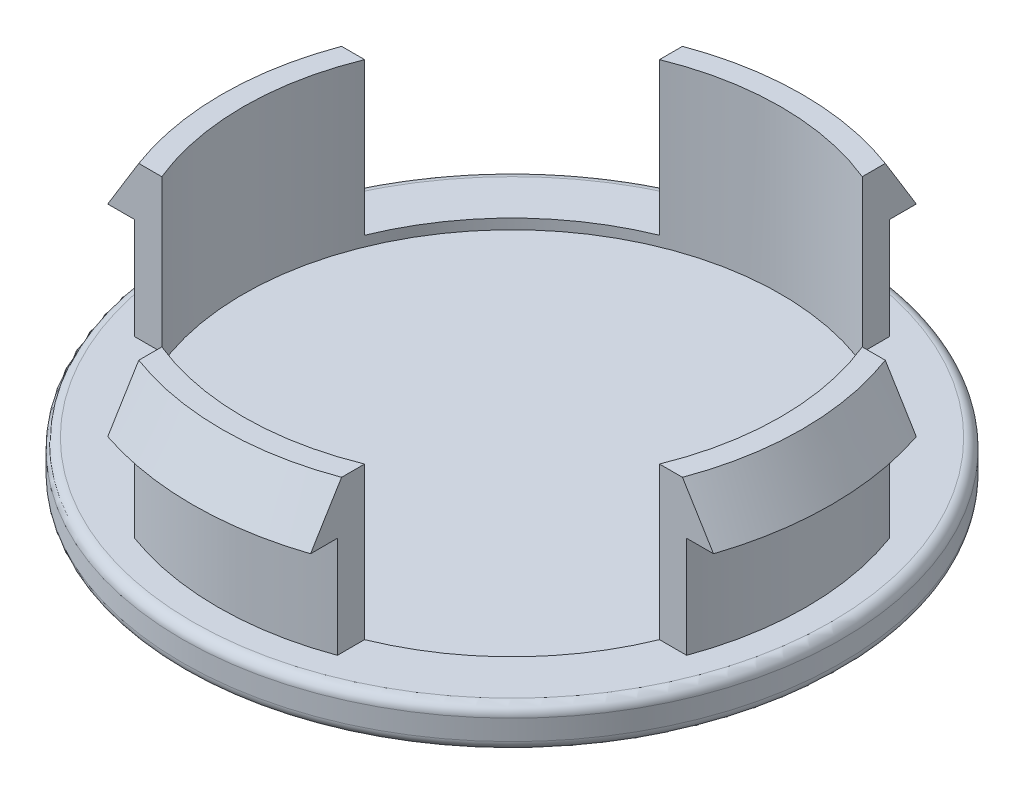
from build123d import *

# Parameters (mm, degrees)
CUT_EXTRUDE_1_REACH = 51.734


with BuildPart() as part:
    # Эскиз1 → Повернуть1 (revolve)
    with BuildSketch(Plane.XY, mode=Mode.PRIVATE) as revolve_1_sk:
        with BuildLine():
            Line((0, 0), (-31.5, 0))
            ThreePointArc((-31.5, 0), (-32.207106781, 0.292893219), (-32.5, 1))
            Line((-32.5, 1), (-32.5, 3))
            ThreePointArc((-32.5, 3), (-32.207106781, 3.707106781), (-31.5, 4))
            Line((-31.5, 4), (-29, 4))
            Line((-29, 4), (-29, 14))
            Line((-29, 14), (-31.5, 14))
            Line((-31.5, 14), (-28.613248654, 19))
            Line((-28.613248654, 19), (-26.5, 19))
            Line((-26.5, 19), (-26.5, 3))
            Line((-26.5, 3), (0, 3))
            Line((0, 3), (0, 0))
        make_face()
    revolve(revolve_1_sk.sketch.rotate(Axis((0, 0, 0), (0, -1, 0)), 270), axis=Axis((0, 0, 0), (0, -1, 0)))

    # Вырез-Вытянуть1: up to this face of the body (flat: up to its plane)
    cut_extrude_1_end = Plane(part.part.faces().sort_by_distance((0, 4, -30.609045456))[0])
    # Эскиз2 → Вырез-Вытянуть1 (cut, up to the picked face)
    with BuildSketch(Plane(origin=(0, 19, 0), x_dir=(1, 0, 0), z_dir=(0, 1, 0)), mode=Mode.PRIVATE) as cut_extrude_1_sk1:
        with BuildLine():
            Line((-10, 26.8089164), (-10, 40.856644609))
            ThreePointArc((-10, 40.856644609), (-29.742775667, 29.742775667), (-40.856644609, 10))
            Line((-40.856644609, 10), (-26.8089164, 10))
            ThreePointArc((-26.8089164, 10), (-20.232622155, 20.232622155), (-10, 26.8089164))
        make_face()
    cut_extrude_1_tool1 = split(extrude(cut_extrude_1_sk1.sketch, amount=-CUT_EXTRUDE_1_REACH, mode=Mode.PRIVATE), bisect_by=cut_extrude_1_end, keep=Keep.BOTH, mode=Mode.PRIVATE)
    # Эскиз2 → Вырез-Вытянуть1 (cut, up to the picked face)
    with BuildSketch(Plane(origin=(0, 19, 0), x_dir=(1, 0, 0), z_dir=(0, 1, 0)), mode=Mode.PRIVATE) as cut_extrude_1_sk2:
        with BuildLine():
            ThreePointArc((26.8089164, 10), (20.232622155, 20.232622155), (10, 26.8089164))
            Line((10, 26.8089164), (10, 24.540782384))
            ThreePointArc((10, 24.540782384), (18.738329701, 18.738329701), (24.540782384, 10))
            Line((24.540782384, 10), (26.8089164, 10))
        make_face()
    cut_extrude_1_tool2 = split(extrude(cut_extrude_1_sk2.sketch, amount=-CUT_EXTRUDE_1_REACH, mode=Mode.PRIVATE), bisect_by=cut_extrude_1_end, keep=Keep.BOTH, mode=Mode.PRIVATE)
    # Эскиз2 → Вырез-Вытянуть1 (cut, up to the picked face)
    with BuildSketch(Plane(origin=(0, 19, 0), x_dir=(1, 0, 0), z_dir=(0, 1, 0)), mode=Mode.PRIVATE) as cut_extrude_1_sk3:
        with BuildLine():
            ThreePointArc((40.856644609, 10), (29.742775667, 29.742775667), (10, 40.856644609))
            Line((10, 40.856644609), (10, 26.8089164))
            ThreePointArc((10, 26.8089164), (20.232622155, 20.232622155), (26.8089164, 10))
            Line((26.8089164, 10), (40.856644609, 10))
        make_face()
    cut_extrude_1_tool3 = split(extrude(cut_extrude_1_sk3.sketch, amount=-CUT_EXTRUDE_1_REACH, mode=Mode.PRIVATE), bisect_by=cut_extrude_1_end, keep=Keep.BOTH, mode=Mode.PRIVATE)
    # Эскиз2 → Вырез-Вытянуть1 (cut, up to the picked face)
    with BuildSketch(Plane(origin=(0, 19, 0), x_dir=(1, 0, 0), z_dir=(0, 1, 0)), mode=Mode.PRIVATE) as cut_extrude_1_sk4:
        with BuildLine():
            ThreePointArc((10, -40.856644609), (29.742775667, -29.742775667), (40.856644609, -10))
            Line((40.856644609, -10), (26.8089164, -10))
            ThreePointArc((26.8089164, -10), (20.232622155, -20.232622155), (10, -26.8089164))
            Line((10, -26.8089164), (10, -40.856644609))
        make_face()
    cut_extrude_1_tool4 = split(extrude(cut_extrude_1_sk4.sketch, amount=-CUT_EXTRUDE_1_REACH, mode=Mode.PRIVATE), bisect_by=cut_extrude_1_end, keep=Keep.BOTH, mode=Mode.PRIVATE)
    # Эскиз2 → Вырез-Вытянуть1 (cut, up to the picked face)
    with BuildSketch(Plane(origin=(0, 19, 0), x_dir=(1, 0, 0), z_dir=(0, 1, 0)), mode=Mode.PRIVATE) as cut_extrude_1_sk5:
        with BuildLine():
            ThreePointArc((10, -26.8089164), (20.232622155, -20.232622155), (26.8089164, -10))
            Line((26.8089164, -10), (24.540782384, -10))
            ThreePointArc((24.540782384, -10), (18.738329701, -18.738329701), (10, -24.540782384))
            Line((10, -24.540782384), (10, -26.8089164))
        make_face()
    cut_extrude_1_tool5 = split(extrude(cut_extrude_1_sk5.sketch, amount=-CUT_EXTRUDE_1_REACH, mode=Mode.PRIVATE), bisect_by=cut_extrude_1_end, keep=Keep.BOTH, mode=Mode.PRIVATE)
    # Эскиз2 → Вырез-Вытянуть1 (cut, up to the picked face)
    with BuildSketch(Plane(origin=(0, 19, 0), x_dir=(1, 0, 0), z_dir=(0, 1, 0)), mode=Mode.PRIVATE) as cut_extrude_1_sk6:
        with BuildLine():
            Line((-26.8089164, -10), (-40.856644609, -10))
            ThreePointArc((-40.856644609, -10), (-29.742775667, -29.742775667), (-10, -40.856644609))
            Line((-10, -40.856644609), (-10, -26.8089164))
            ThreePointArc((-10, -26.8089164), (-20.232622155, -20.232622155), (-26.8089164, -10))
        make_face()
    cut_extrude_1_tool6 = split(extrude(cut_extrude_1_sk6.sketch, amount=-CUT_EXTRUDE_1_REACH, mode=Mode.PRIVATE), bisect_by=cut_extrude_1_end, keep=Keep.BOTH, mode=Mode.PRIVATE)
    # Эскиз2 → Вырез-Вытянуть1 (cut, up to the picked face)
    with BuildSketch(Plane(origin=(0, 19, 0), x_dir=(1, 0, 0), z_dir=(0, 1, 0)), mode=Mode.PRIVATE) as cut_extrude_1_sk7:
        with BuildLine():
            Line((-24.540782384, -10), (-26.8089164, -10))
            ThreePointArc((-26.8089164, -10), (-20.232622155, -20.232622155), (-10, -26.8089164))
            Line((-10, -26.8089164), (-10, -24.540782384))
            ThreePointArc((-10, -24.540782384), (-18.738329701, -18.738329701), (-24.540782384, -10))
        make_face()
    cut_extrude_1_tool7 = split(extrude(cut_extrude_1_sk7.sketch, amount=-CUT_EXTRUDE_1_REACH, mode=Mode.PRIVATE), bisect_by=cut_extrude_1_end, keep=Keep.BOTH, mode=Mode.PRIVATE)
    # Эскиз2 → Вырез-Вытянуть1 (cut, up to the picked face)
    with BuildSketch(Plane(origin=(0, 19, 0), x_dir=(1, 0, 0), z_dir=(0, 1, 0)), mode=Mode.PRIVATE) as cut_extrude_1_sk8:
        with BuildLine():
            Line((-10, 24.540782384), (-10, 26.8089164))
            ThreePointArc((-10, 26.8089164), (-20.232622155, 20.232622155), (-26.8089164, 10))
            Line((-26.8089164, 10), (-24.540782384, 10))
            ThreePointArc((-24.540782384, 10), (-18.738329701, 18.738329701), (-10, 24.540782384))
        make_face()
    cut_extrude_1_tool8 = split(extrude(cut_extrude_1_sk8.sketch, amount=-CUT_EXTRUDE_1_REACH, mode=Mode.PRIVATE), bisect_by=cut_extrude_1_end, keep=Keep.BOTH, mode=Mode.PRIVATE)
    add(cut_extrude_1_tool1.solids().sort_by(Axis((-24.400112, 19, -24.400112), (0, -1, 0)))[0], mode=Mode.SUBTRACT)
    add(cut_extrude_1_tool2.solids().sort_by(Axis((18.950359, 19, -18.950359), (0, -1, 0)))[0], mode=Mode.SUBTRACT)
    add(cut_extrude_1_tool3.solids().sort_by(Axis((24.400112, 19, -24.400112), (0, -1, 0)))[0], mode=Mode.SUBTRACT)
    add(cut_extrude_1_tool4.solids().sort_by(Axis((24.400112, 19, 24.400112), (0, -1, 0)))[0], mode=Mode.SUBTRACT)
    add(cut_extrude_1_tool5.solids().sort_by(Axis((18.950359, 19, 18.950359), (0, -1, 0)))[0], mode=Mode.SUBTRACT)
    add(cut_extrude_1_tool6.solids().sort_by(Axis((-24.400112, 19, 24.400112), (0, -1, 0)))[0], mode=Mode.SUBTRACT)
    add(cut_extrude_1_tool7.solids().sort_by(Axis((-18.950359, 19, 18.950359), (0, -1, 0)))[0], mode=Mode.SUBTRACT)
    add(cut_extrude_1_tool8.solids().sort_by(Axis((-18.950359, 19, -18.950359), (0, -1, 0)))[0], mode=Mode.SUBTRACT)


solid = part.part
